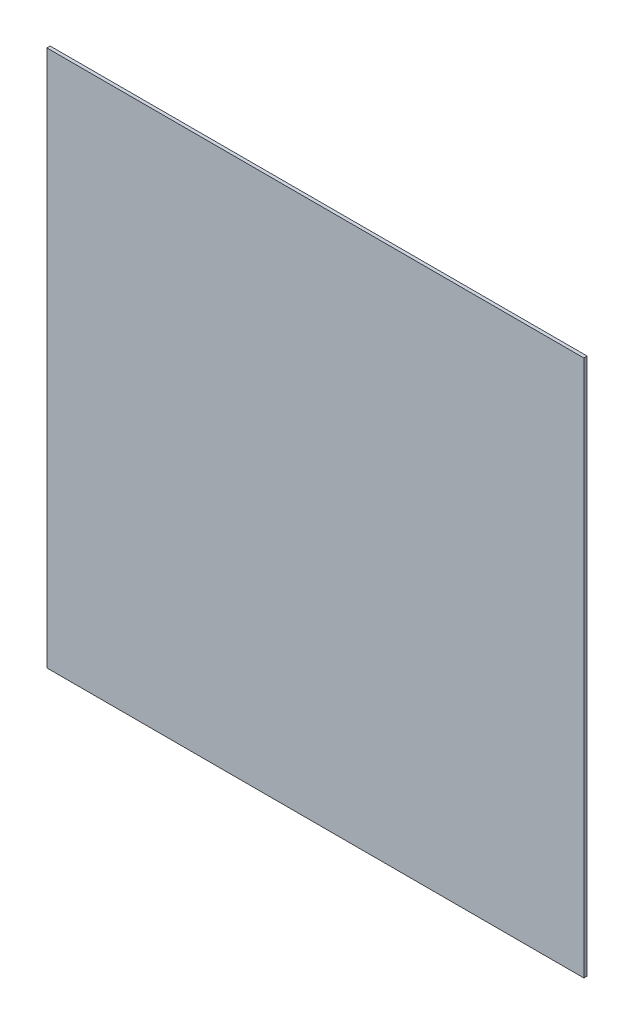
from build123d import *

# Parameters (mm, degrees)
SKETCH1_W           = 12
SKETCH1_H           = 12
BOSS_EXTRUDE1_DEPTH = 0.07366


with BuildPart() as part:
    # Sketch1 → Boss-Extrude1 (new body)
    with BuildSketch(Plane.XY):
        with Locations((56, 0)):
            Rectangle(SKETCH1_W, SKETCH1_H)
    extrude(amount=BOSS_EXTRUDE1_DEPTH)


solid = part.part
